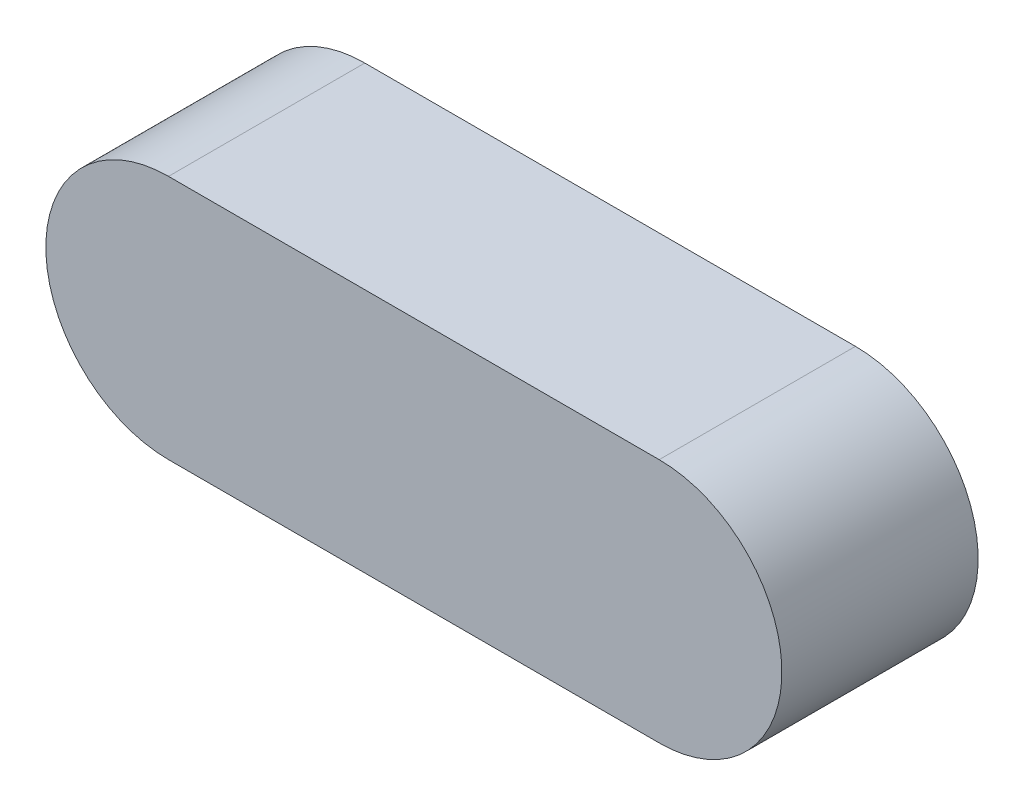
from build123d import *

# Parameters (mm, degrees)
ESTRUSIONE_ESTRUSIONE1_DEPTH = 8


with BuildPart() as part:
    # Schizzo1 → Estrusione-Estrusione1 (new body)
    with BuildSketch(Plane.XY):
        with BuildLine():
            Line((0, 5), (20, 5))
            ThreePointArc((20, 5), (25, 0), (20, -5))
            Line((20, -5), (0, -5))
            ThreePointArc((0, -5), (-5, 0), (0, 5))
        make_face()
    extrude(amount=ESTRUSIONE_ESTRUSIONE1_DEPTH)


solid = part.part
